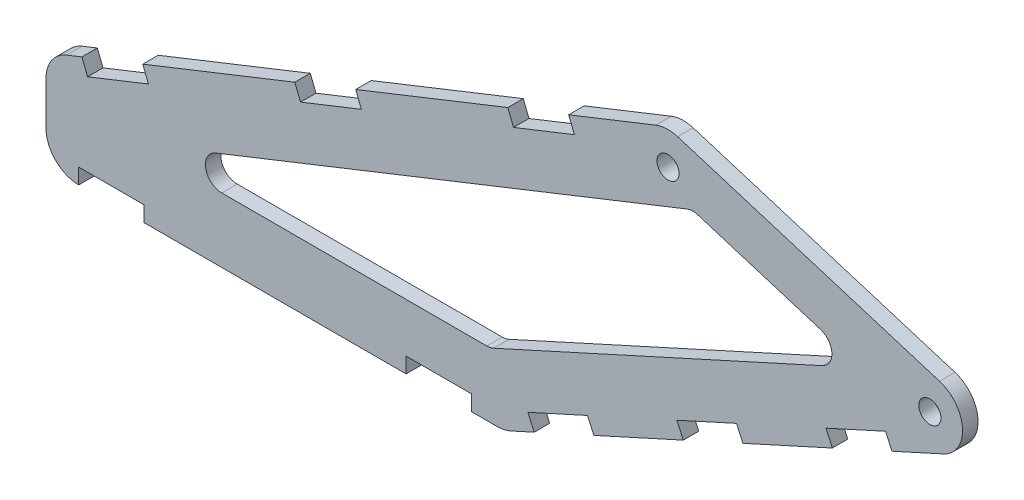
from build123d import *

# Parameters (mm, degrees)
BASE_DEPTH              = 2.9972
JOINT_HOLES_D           = 4.3053
JOINT_HOLES_DEPTH       = 6.351016
OUTER_FILLET_R          = 6.35
SKETCH5_W               = 12.7
SKETCH5_H               = 2.9972
BASE_PLATE_SLOTS_DEPTH  = 142.562822885
UNDER_PLATE_SLOTS_DEPTH = 142.562822885
TOP_PLATE_SLOTS_DEPTH   = 142.562822885
INNER_HOLE_DEPTH        = 142.562822885
INNER_FILLET_R          = 3.175


with BuildPart() as part:
    # Sketch2 → Base (new body)
    with BuildSketch(Plane.XY):
        with BuildLine():
            Line((-44.45, -19.05), (44.45, -19.05))
            Line((44.45, -19.05), (129.624951321, 19.617947547))
            ThreePointArc((129.624951321, 19.617947547), (133.337217148, 25.802714314), (128.871921697, 31.467817496))
            Line((128.871921697, 31.467817496), (78.071921697, 47.139617496))
            ThreePointArc((78.071921697, 47.139617496), (75.950116907, 47.416881437), (73.856688269, 46.973612445))
            Line((73.856688269, 46.973612445), (-44.45, 0))
            Line((-44.45, 0), (-44.45, -19.05))
        make_face()
    extrude(amount=BASE_DEPTH)

    # Joint holes
    with Locations(Plane.XY.offset(2.9972)):
        with Locations((76.2, 41.0718), (127, 25.4)):
            Hole(JOINT_HOLES_D / 2, depth=JOINT_HOLES_DEPTH)

    # Outer fillet
    outer_fillet_edges = [part.edges().sort_by_distance(p)[0] for p in [
        (-44.45, 0, 1.4986),
        (44.45, -19.05, 1.4986),
        (-44.45, -19.05, 1.4986),
    ]]
    fillet(outer_fillet_edges, radius=OUTER_FILLET_R)

    # Sketch5 → Base plate slots (cut, through all)
    with BuildSketch(Plane.XY.offset(2.9972)):
        with Locations((-31.75, -17.5514)):
            Rectangle(SKETCH5_W, SKETCH5_H)
        with Locations((31.75, -17.5514)):
            Rectangle(SKETCH5_W, SKETCH5_H)
    extrude(amount=-BASE_PLATE_SLOTS_DEPTH, mode=Mode.SUBTRACT)

    # Sketch6 → Under plate slots (cut, through all)
    with BuildSketch(Plane.XY.offset(2.9972)):
        Polygon((50.260345678, -16.412204047), (49.021368655, -13.683075289), (60.58547356, -8.433172648), (61.824450584, -11.162301405), align=None)
        Polygon((79.170607941, -3.287447443), (77.931630918, -0.558318686), (89.495735823, 4.691583955), (90.734712847, 1.962455198), align=None)
        Polygon((108.080870204, 9.83730916), (106.841893181, 12.566437917), (118.405998086, 17.816340558), (119.644975109, 15.087211801), align=None)
    extrude(amount=-UNDER_PLATE_SLOTS_DEPTH, mode=Mode.SUBTRACT)

    # Sketch7 → Top plate slots (cut, through all)
    with BuildSketch(Plane.XY.offset(2.9972)):
        Polygon((-37.492405509, 2.762509474), (-36.386362372, -0.023146), (-24.582737483, 4.663477462), (-25.68878062, 7.449132936), align=None)
        Polygon((3.820281603, 19.165691592), (4.92632474, 16.380036118), (16.729949629, 21.06665958), (15.623906492, 23.852315054), align=None)
        Polygon((45.132968715, 35.56887371), (46.239011852, 32.783218236), (58.042636741, 37.469841698), (56.936593604, 40.255497172), align=None)
    extrude(amount=-TOP_PLATE_SLOTS_DEPTH, mode=Mode.SUBTRACT)

    # Sketch8 → Inner hole (cut, through all)
    with BuildSketch(Plane.XY.offset(2.9972)):
        Polygon((-26.957611693, -6.5278), (80.903097736, 36.298241679), (113.752323838, 26.164255426), (41.740634412, -6.5278), align=None)
    extrude(amount=-INNER_HOLE_DEPTH, mode=Mode.SUBTRACT)

    # Inner fillet
    inner_fillet_edges = [part.edges().sort_by_distance(p)[0] for p in [
        (41.740634412, -6.5278, 1.4986),
        (-26.957611693, -6.5278, 1.4986),
        (80.903097736, 36.298241679, 1.4986),
        (113.752323838, 26.164255426, 1.4986),
    ]]
    fillet(inner_fillet_edges, radius=INNER_FILLET_R)


solid = part.part
